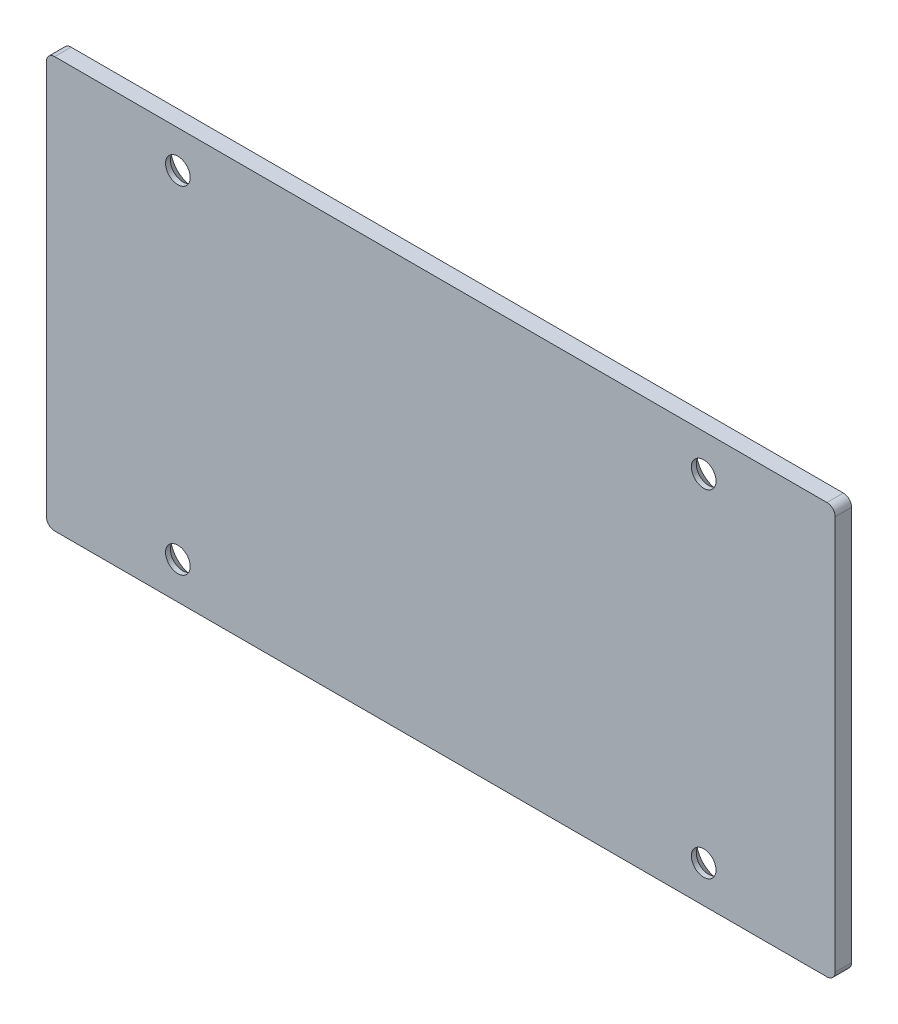
from build123d import *

# Parameters (mm, degrees)
SKETCH_1_R      = 1.5
EXTRUDE_2_DEPTH = 2
CHAMFER_1_SIZE  = 1.4


with BuildPart() as part:
    # Эскиз1 → Бобышка-Вытянуть2 (new body)
    with BuildSketch(Plane(origin=(0, 0, 60.753798787), x_dir=(-1, 0, 0), z_dir=(0, 0, -1))):
        with BuildLine():
            Line((-84.550134069, 64.543755027), (-84.550134069, 29.543755027))
            Line((-84.550134069, 29.543755027), (-84.550134069, 23.043755027))
            ThreePointArc((-84.550134069, 23.043755027), (-84.25724085, 22.336648246), (-83.550134069, 22.043755027))
            Line((-83.550134069, 22.043755027), (10.449865931, 22.043755027))
            ThreePointArc((10.449865931, 22.043755027), (11.156972713, 22.336648246), (11.449865931, 23.043755027))
            Line((11.449865931, 23.043755027), (11.449865931, 71.043755027))
            ThreePointArc((11.449865931, 71.043755027), (11.156972713, 71.750861809), (10.449865931, 72.043755027))
            Line((10.449865931, 72.043755027), (-83.550134069, 72.043755027))
            ThreePointArc((-83.550134069, 72.043755027), (-84.25724085, 71.750861809), (-84.550134069, 71.043755027))
            Line((-84.550134069, 71.043755027), (-84.550134069, 64.543755027))
        make_face()
        with Locations((-4.550134069, 67.543755027)):
            Circle(SKETCH_1_R, mode=Mode.SUBTRACT)
        with Locations((-68.550134069, 67.543755027)):
            Circle(SKETCH_1_R, mode=Mode.SUBTRACT)
        with Locations((-68.550134069, 26.543755027)):
            Circle(SKETCH_1_R, mode=Mode.SUBTRACT)
        with Locations((-4.550134069, 26.543755027)):
            Circle(SKETCH_1_R, mode=Mode.SUBTRACT)
    extrude(amount=EXTRUDE_2_DEPTH)

    # Фаска1
    chamfer_1_edges = [part.edges().sort_by_distance(p)[0] for p in [
        (6.050134069, 67.543755027, 58.753798787),
        (70.050134069, 67.543755027, 58.753798787),
        (70.050134069, 26.543755027, 58.753798787),
        (6.050134069, 26.543755027, 58.753798787),
    ]]
    chamfer(chamfer_1_edges, length=CHAMFER_1_SIZE)


solid = part.part
